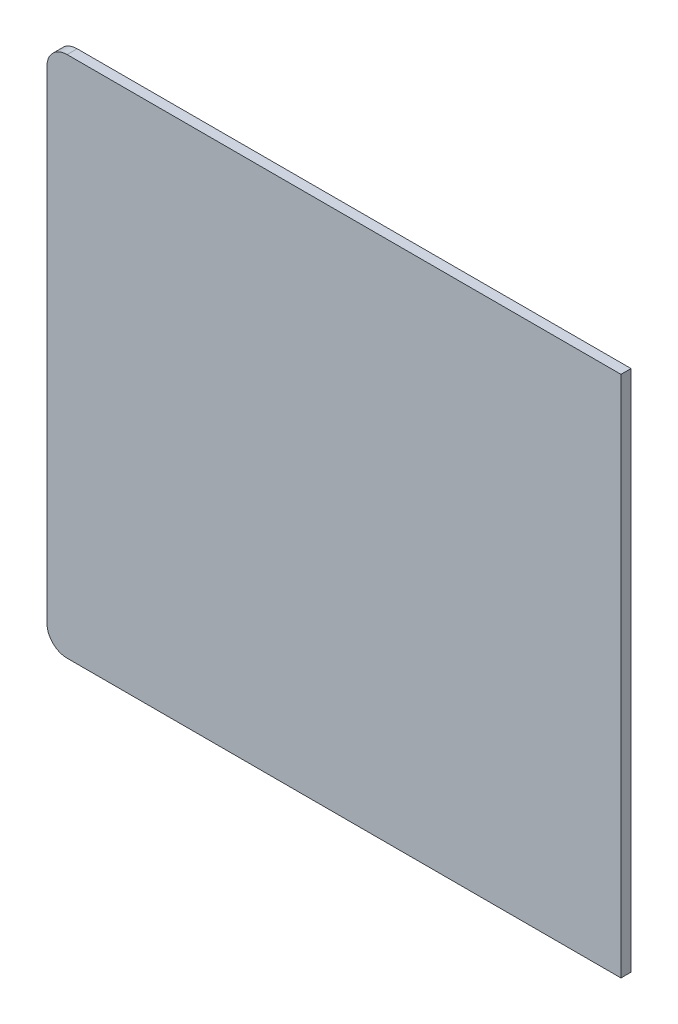
from build123d import *

# Parameters (mm, degrees)
SKETCH1_W           = 250
SKETCH1_H           = 260
BOSS_EXTRUDE1_DEPTH = 5
FILLET1_R           = 10
SKETCH2_W           = 35.474180531
SKETCH2_H           = 260
BOSS_EXTRUDE2_DEPTH = 5


with BuildPart() as part:
    # Sketch1 → Boss-Extrude1 (new body)
    with BuildSketch(Plane.XY):
        Rectangle(SKETCH1_W, SKETCH1_H)
    extrude(amount=BOSS_EXTRUDE1_DEPTH)

    # Fillet1
    fillet1_edges = [part.edges().sort_by_distance(p)[0] for p in [
        (-125, -130, 2.5),
        (-125, 130, 2.5),
    ]]
    fillet(fillet1_edges, radius=FILLET1_R)

    # Sketch2 → Boss-Extrude2 (add)
    with BuildSketch(Plane(origin=(0, 0, 0), x_dir=(-1, 0, 0), z_dir=(0, 0, -1))):
        with Locations((-142.737090266, 0)):
            Rectangle(SKETCH2_W, SKETCH2_H)
    extrude(amount=-BOSS_EXTRUDE2_DEPTH)


solid = part.part
